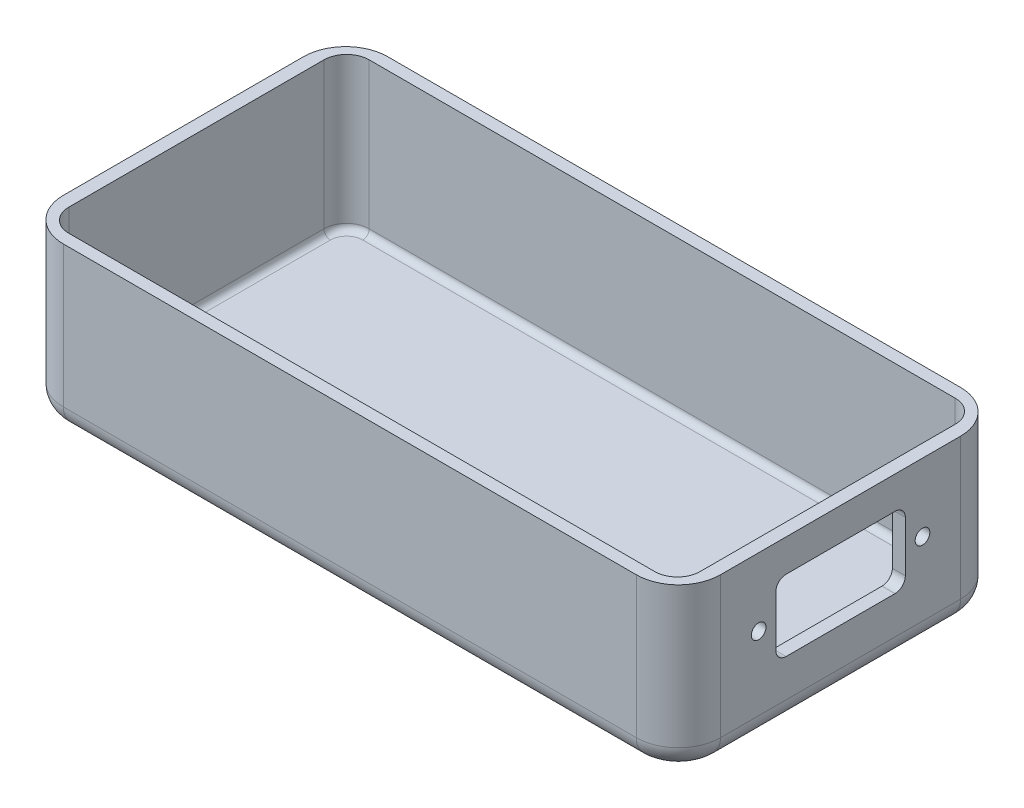
from build123d import *

# Parameters (mm, degrees)
SKETCH1_W                     = 101.5
SKETCH1_H                     = 50.1
BOSS_EXTRUDE1_DEPTH           = 25.3
FILLET1_R                     = 6.5
FILLET2_R                     = 3.5
CUT_EXTRUDE1_DEPTH            = 23.6
FILLET3_R                     = 1
CUT_EXTRUDE2_REACH            = 107.678
SKETCH3_W                     = 20
SKETCH3_H                     = 11
TAP_DRILL_FOR_4_40_TAP1_D     = 2.2606
TAP_DRILL_FOR_4_40_TAP1_DEPTH = 2
F_1_8_END_MILL_R              = 1.5875


with BuildPart() as part:
    # Sketch1 → Boss-Extrude1 (new body)
    with BuildSketch(Plane(origin=(0, 0, 0), x_dir=(1, 0, 0), z_dir=(0, 1, 0))):
        Rectangle(SKETCH1_W, SKETCH1_H)
    extrude(amount=BOSS_EXTRUDE1_DEPTH)

    # Fillet1
    fillet1_edges = [part.edges().sort_by_distance(p)[0] for p in [
        (50.75, 12.65, 25.05),
        (-50.75, 12.65, 25.05),
        (-50.75, 12.65, -25.05),
        (50.75, 12.65, -25.05),
    ]]
    fillet(fillet1_edges, radius=FILLET1_R)

    # Fillet2
    fillet2_edges = [part.edges().sort_by_distance(p)[0] for p in [
        (-50.75, 0, 0),
        (50.75, 0, 0),
        (0, 0, 25.05),
        (0, 0, -25.05),
        (48.846194078, 0, 23.146194078),
        (-48.846194078, 0, 23.146194078),
        (48.846194078, 0, -23.146194078),
        (-48.846194078, 0, -23.146194078),
    ]]
    fillet(fillet2_edges, radius=FILLET2_R)

    # Sketch2 → Cut-Extrude1 (cut)
    with BuildSketch(Plane(origin=(0, 25.3, 0), x_dir=(1, 0, 0), z_dir=(0, 1, 0))):
        with BuildLine():
            Line((-45.25, 23.2), (45.25, 23.2))
            ThreePointArc((45.25, 23.2), (47.724873734, 22.174873734), (48.75, 19.7))
            Line((48.75, 19.7), (48.75, -19.7))
            ThreePointArc((48.75, -19.7), (47.724873734, -22.174873734), (45.25, -23.2))
            Line((45.25, -23.2), (-45.25, -23.2))
            ThreePointArc((-45.25, -23.2), (-47.724873734, -22.174873734), (-48.75, -19.7))
            Line((-48.75, -19.7), (-48.75, 19.7))
            ThreePointArc((-48.75, 19.7), (-47.724873734, 22.174873734), (-45.25, 23.2))
        make_face()
    extrude(amount=-CUT_EXTRUDE1_DEPTH, mode=Mode.SUBTRACT)

    # Fillet3
    fillet3_edges = [part.edges().sort_by_distance(p)[0] for p in [
        (47.724873734, 1.7, -22.174873734),
        (48.75, 1.7, 0),
        (47.724873734, 1.7, 22.174873734),
        (0, 1.7, 23.2),
        (-47.724873734, 1.7, 22.174873734),
        (-48.75, 1.7, 0),
        (-47.724873734, 1.7, -22.174873734),
        (0, 1.7, -23.2),
    ]]
    fillet(fillet3_edges, radius=FILLET3_R)

    # Sketch3 → Cut-Extrude2 (cut, up to next)
    with BuildSketch(Plane.ZY.offset(-48.75), mode=Mode.PRIVATE) as cut_extrude2_sk1:
        with Locations((0, 14.8)):
            Rectangle(SKETCH3_W, SKETCH3_H)
    cut_extrude2_tool1 = extrude(cut_extrude2_sk1.sketch, amount=-CUT_EXTRUDE2_REACH, mode=Mode.PRIVATE) & part.part
    add(cut_extrude2_tool1.solids().sort_by_distance((48.75, 14.8, 0))[0], mode=Mode.SUBTRACT)

    # Tap Drill for #4-40 Tap1
    with Locations(Plane(origin=(50.75, 0, 0), x_dir=(0, 0, -1), z_dir=(1, 0, 0))):
        with Locations((-12.65, 14.8), (12.65, 14.8)):
            Hole(TAP_DRILL_FOR_4_40_TAP1_D / 2, depth=TAP_DRILL_FOR_4_40_TAP1_DEPTH)

    # 1/8" end mill
    f_1_8_end_mill_edges = [part.edges().sort_by_distance(p)[0] for p in [
        (49.75, 20.3, -10),
        (49.75, 20.3, 10),
        (49.75, 9.3, 10),
        (49.75, 9.3, -10),
    ]]
    fillet(f_1_8_end_mill_edges, radius=F_1_8_END_MILL_R)


solid = part.part
